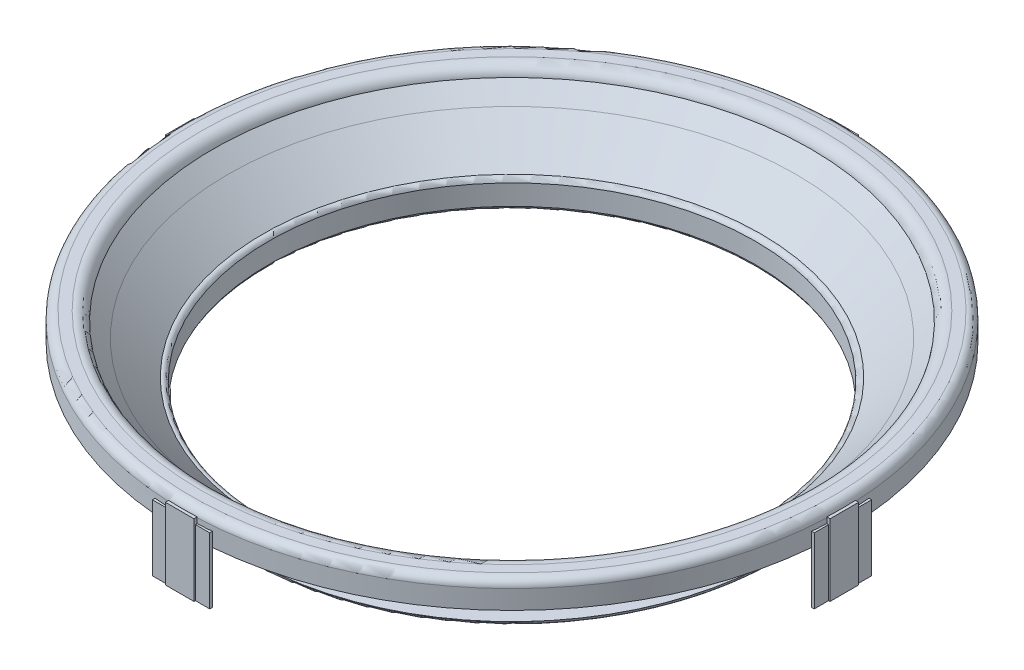
from build123d import *

# Parameters (mm, degrees)
FILLET2_R           = 0.2
BOSS_EXTRUDE1_DEPTH = 1
SKETCH4_R           = 0.153213077
CUT_EXTRUDE1_DEPTH  = 1
SKETCH6_W           = 0.2
SKETCH6_H           = 4
SKETCH6_W_2         = 4
SKETCH6_H_2         = 0.2
BOSS_EXTRUDE3_DEPTH = 4.6
SKETCH5_W           = 0.4
SKETCH5_H           = 2
SKETCH5_W_2         = 2
SKETCH5_H_2         = 0.4
BOSS_EXTRUDE2_DEPTH = 5


with BuildPart() as part:
    # Sketch1 → Revolve1 (revolve)
    with BuildSketch(Plane.XY, mode=Mode.PRIVATE) as revolve1_sk:
        with BuildLine():
            Line((-25.233953941, 4.384216192), (-25.233953941, 4.725701731))
            ThreePointArc((-25.233953941, 4.725701731), (-25.059314561, 5.112459467), (-24.662346854, 5.262449795))
            Line((-24.662346854, 5.262449795), (-24.493245747, 5.262449795))
            Line((-24.493245747, 5.262449795), (-24.493245747, 4.70827222))
            Line((-24.493245747, 4.70827222), (-24.111678282, 4.70827222))
            Line((-24.111678282, 4.70827222), (-24.111678282, 5.259425594))
            ThreePointArc((-24.111678282, 5.259425594), (-23.69503915, 5.040700049), (-23.48706953, 4.618589084))
            Line((-23.48706953, 4.618589084), (-22.461764697, 3.593284251))
            ThreePointArc((-22.461764697, 3.593284251), (-22.457381436, 3.48513382), (-22.377808098, 3.411759351))
            Line((-22.377808098, 3.411759351), (-21.256297739, 2.361574277))
            ThreePointArc((-21.256297739, 2.361574277), (-21.173608491, 2.291730044), (-21.065751032, 2.300812841))
            Line((-21.065751032, 2.300812841), (-19.997967278, 1.233029087))
            ThreePointArc((-19.997967278, 1.233029087), (-19.771487823, 1.160800435), (-19.662416034, 0.949581906))
            Line((-19.662416034, 0.949581906), (-19.662416034, 0.183936837))
            ThreePointArc((-19.662416034, 0.183936837), (-19.665266569, -0.072597654), (-19.848679479, -0.251979299))
            Line((-19.848679479, -0.251979299), (-20.951952139, -0.251979299))
            Line((-20.951952139, -0.251979299), (-20.949700564, -0.486081866))
            Line((-20.949700564, -0.486081866), (-19.72102527, -0.486081866))
            ThreePointArc((-19.72102527, -0.486081866), (-19.541832723, -0.38586655), (-19.438422729, -0.208498425))
            Line((-19.438422729, -0.208498425), (-19.438422729, 1.205918216))
            ThreePointArc((-19.438422729, 1.205918216), (-19.585253007, 1.407550081), (-19.831215203, 1.448988446))
            Line((-19.831215203, 1.448988446), (-22.295012621, 3.80924361))
            Line((-22.295012621, 3.80924361), (-23.320317454, 4.834548442))
            ThreePointArc((-23.320317454, 4.834548442), (-23.61718796, 5.334681104), (-24.180754305, 5.478409153))
            Line((-24.180754305, 5.478409153), (-24.880754305, 5.478409153))
            ThreePointArc((-24.880754305, 5.478409153), (-25.287991721, 5.333133477), (-25.470738162, 4.941277543))
            Line((-25.470738162, 4.941277543), (-25.470738162, 3.619675417))
            Line((-25.470738162, 3.619675417), (-25.233953941, 3.619675417))
            Line((-25.233953941, 3.619675417), (-25.233953941, 4.007317266))
            Line((-25.233953941, 4.007317266), (-24.705913954, 4.007317266))
            Line((-24.705913954, 4.007317266), (-24.705913954, 4.384216192))
            Line((-24.705913954, 4.384216192), (-25.233953941, 4.384216192))
        make_face()
    revolve(revolve1_sk.sketch.rotate(Axis((-2.470738162, -0.486081866, 0), (0, 1, 0)), 270), axis=Axis((-2.470738162, -0.486081866, 0), (0, 1, 0)))

    # Fillet2
    fillet2_edges = [part.edges().sort_by_distance(p)[0] for p in [
        (-2.470738162, -0.486081866, 18.478962402),
    ]]
    fillet(fillet2_edges, radius=FILLET2_R)

    # Sketch2 → Boss-Extrude1 (add)
    with BuildSketch(Plane(origin=(-0.871812988, 0, -0.324348396), x_dir=(1, 0, 0), z_dir=(0, 1, 0))):
        with BuildLine():
            Line((-13.237925173, -12.529703489), (-12.658096263, -13.085044468))
            ThreePointArc((-12.658096263, -13.085044468), (-12.644818214, -13.70056567), (-13.260339417, -13.713843719))
            Line((-13.260339417, -13.713843719), (-13.840168327, -13.15850274))
            ThreePointArc((-13.840168327, -13.15850274), (-13.853446375, -12.542981537), (-13.237925173, -12.529703489))
        make_face()
    extrude(amount=BOSS_EXTRUDE1_DEPTH)

    # Sketch4 → Cut-Extrude1 (cut)
    with BuildSketch(Plane(origin=(0, 0, 0), x_dir=(1, 0, 0), z_dir=(0, 1, 0))):
        with Locations(Location((-13.729004141, -13.155687354, 0), (0, 0, 90.529786154))):
            Circle(SKETCH4_R)
        with Locations((-13.056104047, -13.837868828)):
            Circle(SKETCH4_R)
    extrude(amount=CUT_EXTRUDE1_DEPTH, mode=Mode.SUBTRACT)

    # Sketch6 → Boss-Extrude3 (add)
    with BuildSketch(Plane(origin=(0, 0, 0), x_dir=(1, 0, 0), z_dir=(0, 1, 0))):
        with Locations((20.529261838, 0)):
            Rectangle(SKETCH6_W, SKETCH6_H)
        with Locations((-25.470738162, 0)):
            Rectangle(SKETCH6_W, SKETCH6_H)
        with Locations((-2.470738162, 23)):
            Rectangle(SKETCH6_W_2, SKETCH6_H_2)
        with Locations((-2.470738162, -23)):
            Rectangle(SKETCH6_W_2, SKETCH6_H_2)
    extrude(amount=BOSS_EXTRUDE3_DEPTH)

    # Sketch5 → Boss-Extrude2 (add)
    with BuildSketch(Plane(origin=(0, 0, 0), x_dir=(1, 0, 0), z_dir=(0, 1, 0))):
        with Locations((-25.470738162, 0)):
            Rectangle(SKETCH5_W, SKETCH5_H)
        with Locations((-2.470738162, -23)):
            Rectangle(SKETCH5_W_2, SKETCH5_H_2)
        with Locations((20.529261838, 0)):
            Rectangle(SKETCH5_W, SKETCH5_H)
        with Locations((-2.470738162, 23)):
            Rectangle(SKETCH5_W_2, SKETCH5_H_2)
    extrude(amount=BOSS_EXTRUDE2_DEPTH)


solid = part.part
